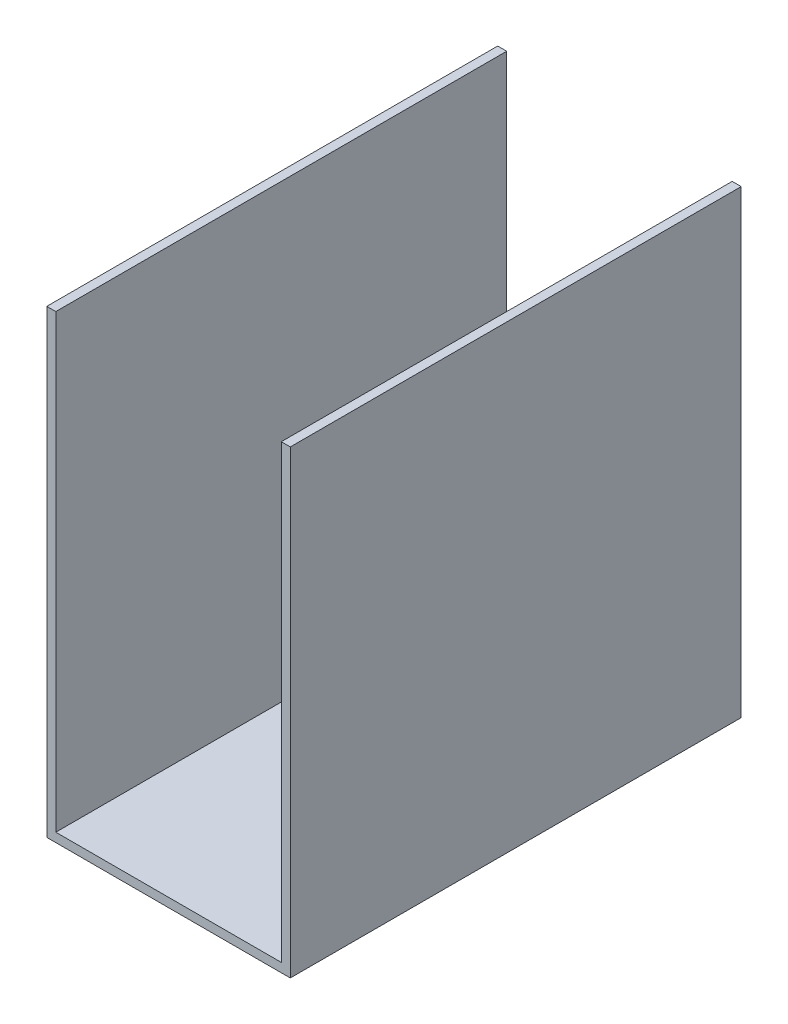
from build123d import *

# Parameters (mm, degrees)
BOSS_EXTRUDE1_DEPTH = 10000


with BuildPart() as part:
    # Sketch2 → Boss-Extrude1 (new body)
    with BuildSketch(Plane.XY):
        Polygon((0, 0), (0, -10000), (5000, -10000), (5000, 0), (5200, 0), (5200, -10200), (-200, -10200), (-200, 0), align=None)
    extrude(amount=-BOSS_EXTRUDE1_DEPTH)


solid = part.part
